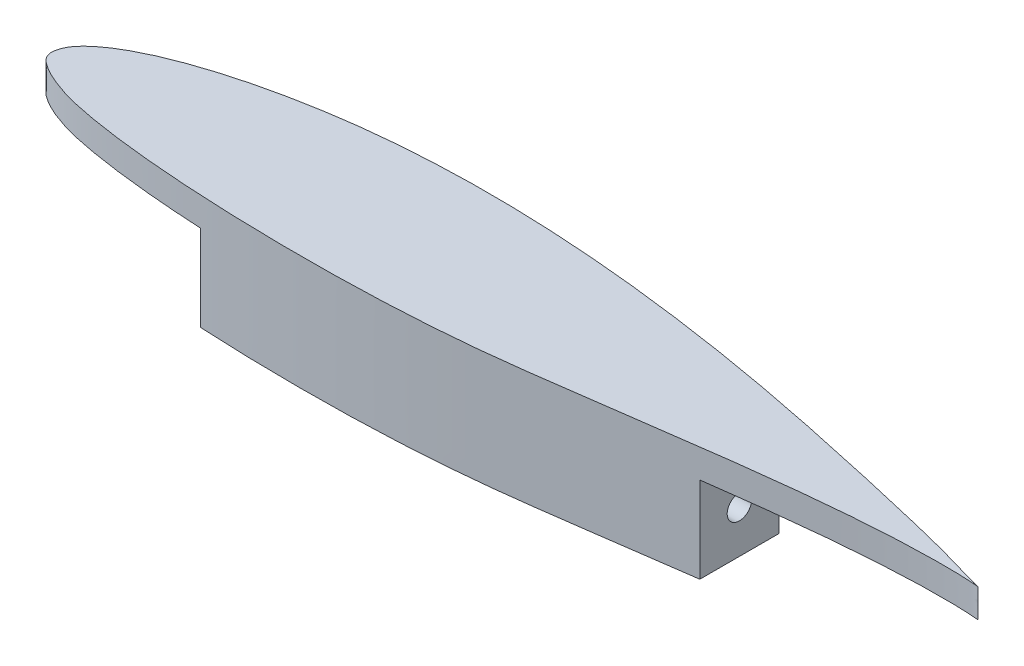
from build123d import *

# Parameters (mm, degrees)
BOSS_EXTRUDE1_DEPTH       = 12.7
SKETCH4_OUTSIDE_W         = 125.525
SKETCH4_OUTSIDE_H         = 39.377
SKETCH4_OUTSIDE_W_2       = 51.825
SKETCH4_OUTSIDE_H_2       = 21.32837878
CUT_EXTRUDE1_DEPTH        = 9.525
F_6_32_TAPPED_HOLE1_D     = 2.7051
F_6_32_TAPPED_HOLE1_DEPTH = 10
F_6_32_TAPPED_HOLE1_TIP   = 0.81269403
F_6_32_TAPPED_HOLE2_D     = 2.7051
F_6_32_TAPPED_HOLE2_DEPTH = 10
F_6_32_TAPPED_HOLE2_TIP   = 0.81269403


with BuildPart() as part:
    # Sketch2 → Boss-Extrude1 (new body)
    with BuildSketch(Plane(origin=(0, 0, 0), x_dir=(1, 0, 0), z_dir=(0, 1, 0))):
        with BuildLine():
            add(Edge.make_bspline(
                [(102.6, 0), (102.600319101, 0.004265457), (102.145671459, 0.094858929), (101.702188288, 0.234738717), (100.655178837, 0.522001277), (99.414247134, 0.895313137), (97.83190678, 1.346828714), (95.983678545, 1.841149365), (93.852786125, 2.3688635), (91.461765277, 2.939836273), (88.829079872, 3.554672691), (85.978997319, 4.203084475), (82.9368868, 4.876667457), (79.730050574, 5.569402023), (76.385147015, 6.265160267), (72.925154511, 6.948663009), (69.367807972, 7.598612692), (65.733607598, 8.211810091), (62.041693267, 8.775306399), (58.312963551, 9.277400281), (54.567826731, 9.719629142), (50.823606575, 10.082706008), (47.100853212, 10.363827792), (43.417399953, 10.560998634), (39.789325222, 10.662492851), (36.233332408, 10.672831395), (32.76424477, 10.585505665), (29.398583254, 10.397809508), (26.148385168, 10.120639683), (23.026319926, 9.749430218), (20.045045473, 9.285750714), (17.215600544, 8.75364503), (14.554479695, 8.155205693), (12.076527603, 7.505020829), (9.797630261, 6.805960925), (7.731314085, 6.068222517), (5.888124405, 5.303285049), (4.281608723, 4.511335797), (2.918902241, 3.710134973), (1.805385034, 2.908929574), (0.954854012, 2.106079646), (0.356698699, 1.303602189), (0.049873755, 0.504187391), (-0.039050931, -0.26583968), (0.282403348, -0.995387885), (0.991514519, -1.554722834), (1.93374298, -2.136322182), (3.170654179, -2.694727019), (4.668221775, -3.230831536), (6.442831262, -3.697940395), (8.488092331, -4.102308642), (10.793911106, -4.47373854), (13.347904382, -4.797078679), (16.128482688, -5.082500231), (19.117760355, -5.320683565), (22.294885104, -5.512485514), (25.638395669, -5.657361035), (29.125909122, -5.749519752), (32.733417585, -5.788020632), (36.437149911, -5.76995187), (40.21453992, -5.682851638), (44.046279471, -5.523685229), (47.91284451, -5.280055949), (51.807317919, -4.943060055), (55.729936467, -4.490033193), (59.684902908, -3.96726339), (63.660071329, -3.41182843), (67.625372933, -2.845107382), (71.549604897, -2.289670908), (75.39834502, -1.762592482), (79.135275058, -1.282029701), (82.722757665, -0.861179281), (86.121868619, -0.508160093), (89.293869952, -0.23207807), (92.199050075, -0.030466017), (94.803444882, 0.096874858), (97.063985975, 0.158580855), (98.979095618, 0.163918067), (100.444029843, 0.141442407), (101.633023735, 0.072065771), (102.123616118, 0.055733379), (102.599678343, -0.004299626), (102.6, 0)],
                knots=[0, 0, 0, 0, 0.001056592, 0.004097294, 0.00889802, 0.015259955, 0.02301923, 0.032101827, 0.042513033, 0.054199242, 0.067047697, 0.080936362, 0.095743297, 0.11133243, 0.127566588, 0.144301819, 0.161458762, 0.178962821, 0.196683552, 0.214537428, 0.23243559, 0.250280433, 0.267999886, 0.285494312, 0.302703723, 0.31958077, 0.336030589, 0.35201851, 0.36748456, 0.382386516, 0.396695769, 0.410359212, 0.423299251, 0.435455133, 0.446762266, 0.457168374, 0.466628427, 0.475110843, 0.482604448, 0.48907559, 0.494562152, 0.499184409, 0.503152123, 0.506644237, 0.509898128, 0.513968073, 0.519248926, 0.525670917, 0.533191112, 0.541844762, 0.551720988, 0.562815354, 0.57503359, 0.588305732, 0.602540571, 0.617651859, 0.633542516, 0.650104607, 0.667235371, 0.684817445, 0.7027443, 0.720935174, 0.739321764, 0.757804969, 0.776487638, 0.795439479, 0.814505578, 0.8335358, 0.852371504, 0.870837034, 0.888748629, 0.905921521, 0.922174577, 0.937319325, 0.951171298, 0.963571262, 0.974351537, 0.983387975, 0.990564331, 0.995766764, 0.998934944, 1, 1, 1, 1], degree=3))
        make_face()
    extrude(amount=BOSS_EXTRUDE1_DEPTH)

    # Sketch4 outside → Cut-Extrude1 (cut)
    with BuildSketch(Plane.XZ):
        with Locations((51.3045, -2.4425)):
            Rectangle(SKETCH4_OUTSIDE_W, SKETCH4_OUTSIDE_H)
        with Locations((47.8625, 0)):
            Rectangle(SKETCH4_OUTSIDE_W_2, SKETCH4_OUTSIDE_H_2, mode=Mode.SUBTRACT)
    extrude(amount=-CUT_EXTRUDE1_DEPTH, mode=Mode.SUBTRACT)

    # #6-32 Tapped Hole1
    with Locations(Plane(origin=(73.775, 0, 0), x_dir=(0, 0, -1), z_dir=(1, 0, 0))):
        with Locations((2.395390338, 4.7625)):
            Hole(F_6_32_TAPPED_HOLE1_D / 2, depth=F_6_32_TAPPED_HOLE1_DEPTH)
            with Locations((0, 0, -(F_6_32_TAPPED_HOLE1_DEPTH + F_6_32_TAPPED_HOLE1_TIP / 2))):  # 118° drill point
                Cone(0, F_6_32_TAPPED_HOLE1_D / 2, F_6_32_TAPPED_HOLE1_TIP, mode=Mode.SUBTRACT)

    # #6-32 Tapped Hole2
    with Locations(Plane.ZY.offset(-21.95)):
        with Locations((-2.528254392, 4.7625)):
            Hole(F_6_32_TAPPED_HOLE2_D / 2, depth=F_6_32_TAPPED_HOLE2_DEPTH)
            with Locations((0, 0, -(F_6_32_TAPPED_HOLE2_DEPTH + F_6_32_TAPPED_HOLE2_TIP / 2))):  # 118° drill point
                Cone(0, F_6_32_TAPPED_HOLE2_D / 2, F_6_32_TAPPED_HOLE2_TIP, mode=Mode.SUBTRACT)


solid = part.part
